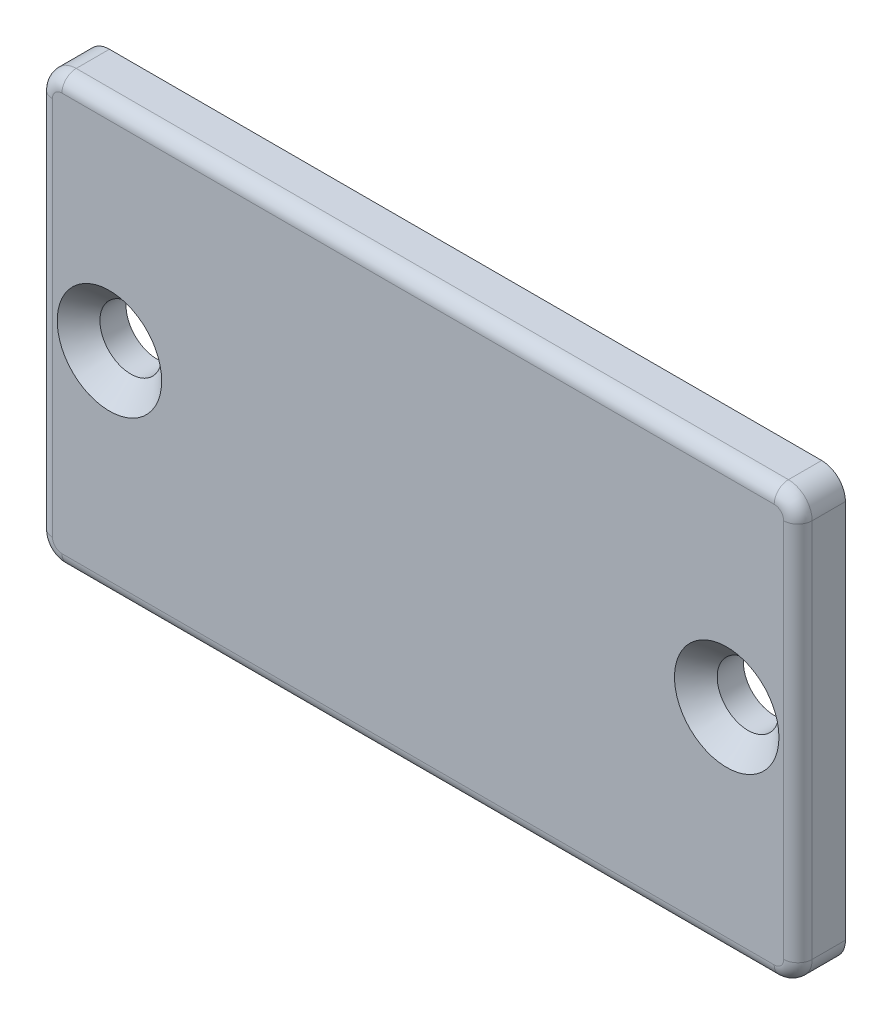
from build123d import *

# Parameters (mm, degrees)
ESQUISSE1_W                                    = 32
ESQUISSE1_H                                    = 18
BOSS_EXTRU_1_DEPTH                             = 2
ESQUISSE2_W                                    = 19
ESQUISSE2_H                                    = 12
BOSS_EXTRU_2_DEPTH                             = 1.4
CONG_1_R                                       = 1
CONG_2_R                                       = 0.6
CONG_3_R                                       = 1
FRAISAGE_POUR_VIS_T_TE_FRAIS_E_M21_D           = 2.6
FRAISAGE_POUR_VIS_T_TE_FRAIS_E_M21_CSINK_D     = 4.4
FRAISAGE_POUR_VIS_T_TE_FRAIS_E_M21_CSINK_ANGLE = 90


with BuildPart() as part:
    # Esquisse1 → Boss.-Extru.1 (new body)
    with BuildSketch(Plane.XY):
        Rectangle(ESQUISSE1_W, ESQUISSE1_H)
    extrude(amount=BOSS_EXTRU_1_DEPTH)

    # Esquisse2 → Boss.-Extru.2 (add)
    with BuildSketch(Plane(origin=(0, 0, 0), x_dir=(-1, 0, 0), z_dir=(0, 0, -1))):
        Rectangle(ESQUISSE2_W, ESQUISSE2_H)
    extrude(amount=BOSS_EXTRU_2_DEPTH)

    # Congé1
    cong_1_edges = [part.edges().sort_by_distance(p)[0] for p in [
        (16, -9, 1),
        (-16, -9, 1),
        (-16, 9, 1),
        (16, 9, 1),
    ]]
    fillet(cong_1_edges, radius=CONG_1_R)

    # Congé2
    cong_2_edges = [part.edges().sort_by_distance(p)[0] for p in [
        (16, 0, 2),
        (0, -9, 2),
        (0, 9, 2),
        (-16, 0, 2),
        (15.707106781, 8.707106781, 2),
        (-15.707106781, 8.707106781, 2),
        (-15.707106781, -8.707106781, 2),
        (15.707106781, -8.707106781, 2),
    ]]
    fillet(cong_2_edges, radius=CONG_2_R)

    # Congé3
    cong_3_edges = [part.edges().sort_by_distance(p)[0] for p in [
        (-9.5, -6, -0.7),
        (-9.5, 6, -0.7),
        (9.5, 6, -0.7),
        (9.5, -6, -0.7),
    ]]
    fillet(cong_3_edges, radius=CONG_3_R)

    # Fraisage pour vis à tête fraisée M21 (through all)
    with Locations(Plane.XY.offset(2)):
        with Locations((-13, 0)):
            fraisage_pour_vis_t_te_frais_e_m21 = CounterSinkHole(FRAISAGE_POUR_VIS_T_TE_FRAIS_E_M21_D / 2, FRAISAGE_POUR_VIS_T_TE_FRAIS_E_M21_CSINK_D / 2, counter_sink_angle=FRAISAGE_POUR_VIS_T_TE_FRAIS_E_M21_CSINK_ANGLE)

    # Symétrie1: Fraisage pour vis à tête fraisée M21 across plane
    add(fraisage_pour_vis_t_te_frais_e_m21.mirror(Plane(origin=(0, 0, 0), x_dir=(0, 0, 1), z_dir=(1, 0, 0))), mode=Mode.SUBTRACT)


solid = part.part
